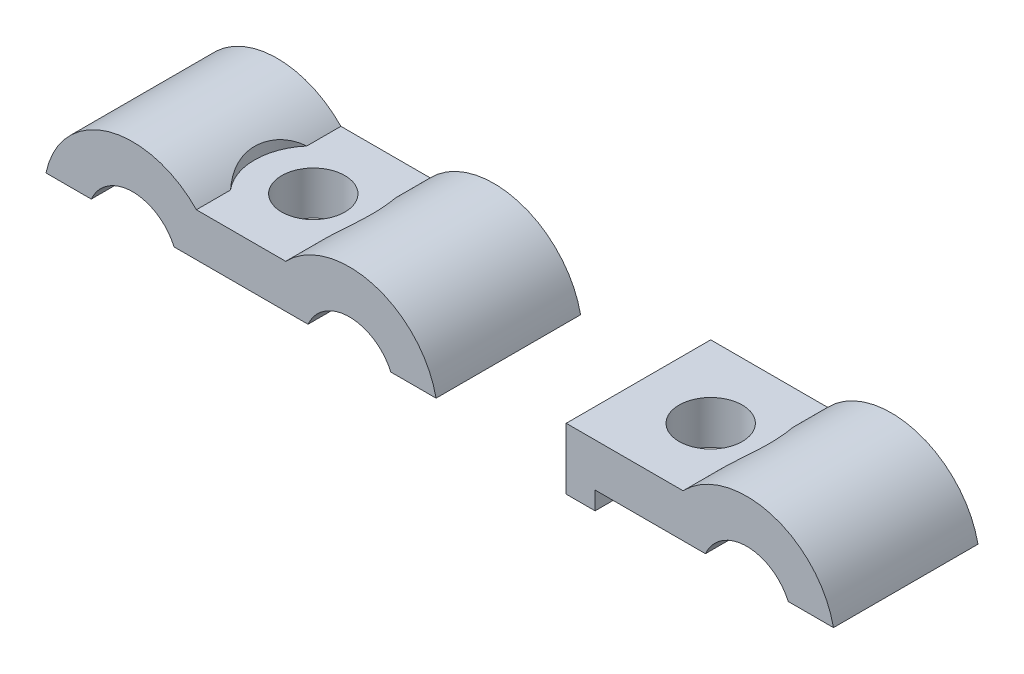
from build123d import *

# Parameters (mm, degrees)
SKICA1_W                 = 1.6
SKICA1_H                 = 1
P_IDAT_VYSUNUT_M1_DEPTH  = 8
SKICA2_R                 = 1.75
ODEBRAT_VYSUNUT_M1_DEPTH = 8
SKICA3_R                 = 3.25
ODEBRAT_VYSUNUT_M2_DEPTH = 8


with BuildPart() as part:
    # Skica1 → Přidat vysunutím1 (new body)
    with BuildSketch(Plane.XY):
        with BuildLine():
            Line((8.291287847, 1), (10.796873982, 1))
            ThreePointArc((10.796873982, 1), (10.332179451, 2.289589745), (9.528455753, 3.4))
            Line((9.528455753, 3.4), (2.471544247, 3.4))
            ThreePointArc((2.471544247, 3.4), (1.667820549, 2.289589745), (1.203126018, 1))
            Line((1.203126018, 1), (3.708712153, 1))
            ThreePointArc((3.708712153, 1), (6, 2.5), (8.291287847, 1))
        make_face()
        with BuildLine():
            Line((2.471544247, 3.4), (9.528455753, 3.4))
            ThreePointArc((9.528455753, 3.4), (6, 4.9), (2.471544247, 3.4))
        make_face()
        with BuildLine():
            Line((10.796873982, 1), (13.203126018, 1))
            ThreePointArc((13.203126018, 1), (13.667820549, 2.289589745), (14.471544247, 3.4))
            Line((14.471544247, 3.4), (9.528455753, 3.4))
            ThreePointArc((9.528455753, 3.4), (10.332179451, 2.289589745), (10.796873982, 1))
        make_face()
        with BuildLine():
            Line((20.291287847, 1), (22.796873982, 1))
            ThreePointArc((22.796873982, 1), (22.332179451, 2.289589745), (21.528455753, 3.4))
            Line((21.528455753, 3.4), (14.471544247, 3.4))
            ThreePointArc((14.471544247, 3.4), (13.667820549, 2.289589745), (13.203126018, 1))
            Line((13.203126018, 1), (15.708712153, 1))
            ThreePointArc((15.708712153, 1), (18, 2.5), (20.291287847, 1))
        make_face()
        with BuildLine():
            Line((14.471544247, 3.4), (21.528455753, 3.4))
            ThreePointArc((21.528455753, 3.4), (18, 4.9), (14.471544247, 3.4))
        make_face()
        with Locations((30.8, 0.5)):
            Rectangle(SKICA1_W, SKICA1_H)
        with BuildLine():
            Line((30, 3.4), (30, 1))
            Line((30, 1), (31.6, 1))
            Line((31.6, 1), (35.203126018, 1))
            ThreePointArc((35.203126018, 1), (35.667820549, 2.289589745), (36.471544247, 3.4))
            Line((36.471544247, 3.4), (30, 3.4))
        make_face()
        with BuildLine():
            ThreePointArc((36.471544247, 3.4), (35.667820549, 2.289589745), (35.203126018, 1))
            Line((35.203126018, 1), (37.708712153, 1))
            ThreePointArc((37.708712153, 1), (40, 2.5), (42.291287847, 1))
            Line((42.291287847, 1), (44.796873982, 1))
            ThreePointArc((44.796873982, 1), (44.332179451, 2.289589745), (43.528455753, 3.4))
            Line((43.528455753, 3.4), (36.471544247, 3.4))
        make_face()
        with BuildLine():
            ThreePointArc((43.528455753, 3.4), (40, 4.9), (36.471544247, 3.4))
            Line((36.471544247, 3.4), (43.528455753, 3.4))
        make_face()
    extrude(amount=P_IDAT_VYSUNUT_M1_DEPTH)

    # Skica2 → Odebrat vysunutím1 (cut)
    with BuildSketch(Plane(origin=(0, 3.4, 0), x_dir=(1, 0, 0), z_dir=(0, 1, 0))):
        with Locations(Location((12, -4, 0), (0, 0, 270))):
            Circle(SKICA2_R)
        with Locations(Location((34, -4, 0), (0, 0, 270))):
            Circle(SKICA2_R)
    extrude(amount=-ODEBRAT_VYSUNUT_M1_DEPTH, mode=Mode.SUBTRACT)

    # Skica3 → Odebrat vysunutím2 (cut)
    with BuildSketch(Plane(origin=(0, 3.4, 0), x_dir=(1, 0, 0), z_dir=(0, 1, 0))):
        with Locations((12, -4)):
            Circle(SKICA3_R)
        with Locations((34, -4)):
            Circle(SKICA3_R)
    extrude(amount=ODEBRAT_VYSUNUT_M2_DEPTH, mode=Mode.SUBTRACT)


solid = part.part
